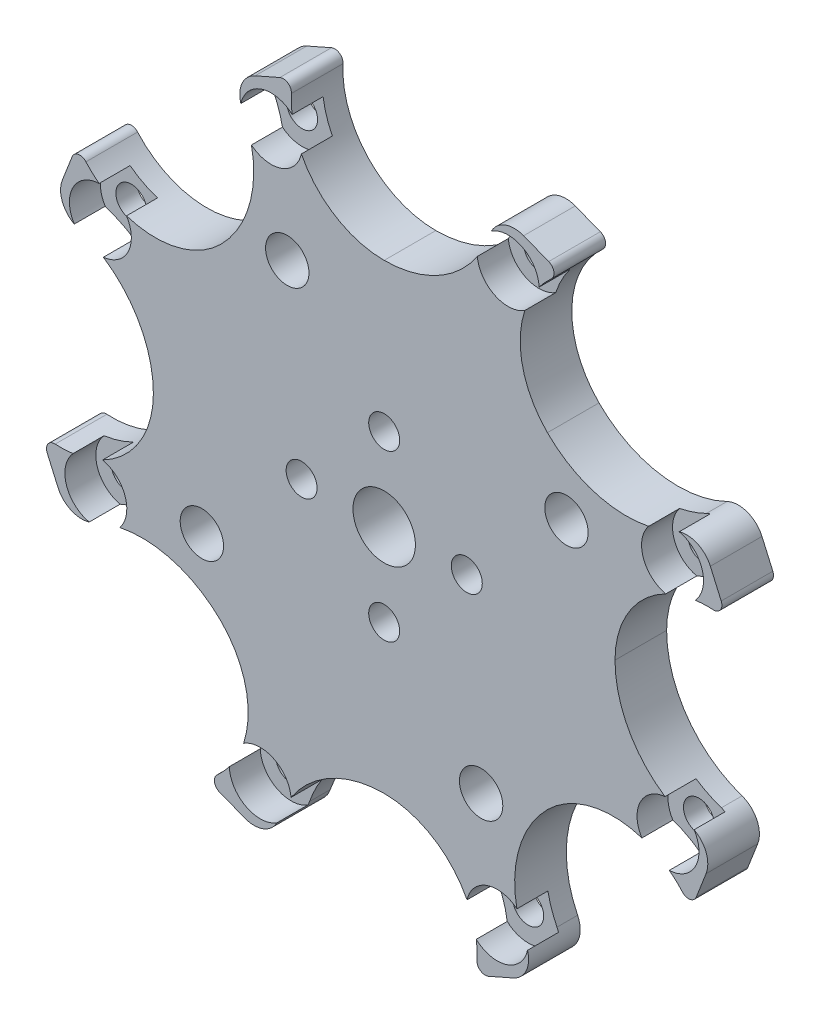
from build123d import *

# Parameters (mm, degrees)
SKETCH_1_R               = 3.025
SKETCH_1_R_2             = 1.5
EXTRUDE_1_DEPTH          = 5
SKETCH_2_R               = 2.1
CUT_EXTRUDE_1_DEPTH      = 10
SKETCH_3_R               = 1.5
CUT_EXTRUDE_3_DEPTH      = 10
SKETCH_4_R               = 0.75
CUT_EXTRUDE_4_DEPTH      = 1
PATTERN_CIRCULAR_1_COUNT = 4
SKETCH_5_R               = 3
CUT_EXTRUDE_5_DEPTH      = 3


with BuildPart() as part:
    # 草图1 → 凸台-拉伸1 (new body)
    with BuildSketch(Plane.XY):
        with BuildLine():
            Line((15.936762996, 30.229618981), (13.50337588, 31.175538906))
            ThreePointArc((13.50337588, 31.175538906), (11.545587701, 31.113280948), (10.233613318, 29.658793469))
            ThreePointArc((10.233613318, 29.658793469), (6.285609854, 24.369935979), (0, 22.357511157))
            ThreePointArc((0, 22.357511157), (-6.541634269, 25.176328334), (-8.985563862, 31.867062025))
            ThreePointArc((-8.985563862, 31.867062025), (-9.328351981, 32.569720668), (-10.106575389, 32.644561759))
            Line((-10.106575389, 32.644561759), (-12.496106314, 31.592763621))
            ThreePointArc((-12.496106314, 31.592763621), (-13.836448588, 30.1643753), (-13.73567661, 28.208191357))
            ThreePointArc((-13.73567661, 28.208191357), (-12.787549636, 21.67674434), (-15.80914775, 15.80914775))
            ThreePointArc((-15.80914775, 15.80914775), (-22.427986442, 13.176718539), (-28.887168794, 16.179662515))
            ThreePointArc((-28.887168794, 16.179662515), (-29.626411288, 16.434129403), (-30.229618981, 15.936762996))
            Line((-30.229618981, 15.936762996), (-31.175538906, 13.50337588))
            ThreePointArc((-31.175538906, 13.50337588), (-31.113280948, 11.545587701), (-29.658793469, 10.233613318))
            ThreePointArc((-29.658793469, 10.233613318), (-24.369935979, 6.285609854), (-22.357511157, 0))
            ThreePointArc((-22.357511157, 0), (-25.176328334, -6.541634269), (-31.867062025, -8.985563862))
            ThreePointArc((-31.867062025, -8.985563862), (-32.569720668, -9.328351981), (-32.644561759, -10.106575389))
            Line((-32.644561759, -10.106575389), (-31.592763621, -12.496106314))
            ThreePointArc((-31.592763621, -12.496106314), (-30.1643753, -13.836448588), (-28.208191357, -13.73567661))
            ThreePointArc((-28.208191357, -13.73567661), (-21.67674434, -12.787549636), (-15.80914775, -15.80914775))
            ThreePointArc((-15.80914775, -15.80914775), (-13.176718539, -22.427986442), (-16.179662515, -28.887168794))
            ThreePointArc((-16.179662515, -28.887168794), (-16.434129403, -29.626411288), (-15.936762996, -30.229618981))
            Line((-15.936762996, -30.229618981), (-13.50337588, -31.175538906))
            ThreePointArc((-13.50337588, -31.175538906), (-11.545587701, -31.113280948), (-10.233613318, -29.658793469))
            ThreePointArc((-10.233613318, -29.658793469), (-6.285609854, -24.369935979), (0, -22.357511157))
            ThreePointArc((0, -22.357511157), (6.541634269, -25.176328334), (8.985563862, -31.867062025))
            ThreePointArc((8.985563862, -31.867062025), (9.328351981, -32.569720668), (10.106575389, -32.644561759))
            Line((10.106575389, -32.644561759), (12.496106314, -31.592763621))
            ThreePointArc((12.496106314, -31.592763621), (13.836448588, -30.1643753), (13.73567661, -28.208191357))
            ThreePointArc((13.73567661, -28.208191357), (12.787549636, -21.67674434), (15.80914775, -15.80914775))
            ThreePointArc((15.80914775, -15.80914775), (22.427986442, -13.176718539), (28.887168794, -16.179662515))
            ThreePointArc((28.887168794, -16.179662515), (29.626411288, -16.434129403), (30.229618981, -15.936762996))
            Line((30.229618981, -15.936762996), (31.175538906, -13.50337588))
            ThreePointArc((31.175538906, -13.50337588), (31.113280948, -11.545587701), (29.658793469, -10.233613318))
            ThreePointArc((29.658793469, -10.233613318), (24.369935979, -6.285609854), (22.357511157, 0))
            ThreePointArc((22.357511157, 0), (25.176328334, 6.541634269), (31.867062025, 8.985563862))
            ThreePointArc((31.867062025, 8.985563862), (32.569720668, 9.328351981), (32.644561759, 10.106575389))
            Line((32.644561759, 10.106575389), (31.592763621, 12.496106314))
            ThreePointArc((31.592763621, 12.496106314), (30.1643753, 13.836448588), (28.208191357, 13.73567661))
            ThreePointArc((28.208191357, 13.73567661), (21.67674434, 12.787549636), (15.80914775, 15.80914775))
            ThreePointArc((15.80914775, 15.80914775), (13.176718539, 22.427986442), (16.179662515, 28.887168794))
            ThreePointArc((16.179662515, 28.887168794), (16.434129403, 29.626411288), (15.936762996, 30.229618981))
        make_face()
        Circle(SKETCH_1_R, mode=Mode.SUBTRACT)
        with Locations((-8, 0)):
            Circle(SKETCH_1_R_2, mode=Mode.SUBTRACT)
        with Locations((0, 8)):
            Circle(SKETCH_1_R_2, mode=Mode.SUBTRACT)
        with Locations((8, 0)):
            Circle(SKETCH_1_R_2, mode=Mode.SUBTRACT)
        with Locations((0, -8)):
            Circle(SKETCH_1_R_2, mode=Mode.SUBTRACT)
    extrude(amount=EXTRUDE_1_DEPTH)

    # 草图2 → 切除-拉伸1 (cut)
    with BuildSketch(Plane.XY.offset(5)):
        with Locations((-17.658951857, -9.389431256)):
            Circle(SKETCH_2_R)
        with Locations((-9.389431256, 17.658951857)):
            Circle(SKETCH_2_R)
        with Locations((17.658951857, 9.389431256)):
            Circle(SKETCH_2_R)
        with Locations((9.389431256, -17.658951857)):
            Circle(SKETCH_2_R)
    extrude(amount=-CUT_EXTRUDE_1_DEPTH, mode=Mode.SUBTRACT)

    # 草图3 → 切除-拉伸3 (cut)
    with BuildSketch(Plane.XY.offset(5)):
        with Locations((-10.95008804, 27.930191047)):
            Circle(SKETCH_3_R)
        with Locations((12.006745981, 27.492508997)):
            Circle(SKETCH_3_R)
        with Locations((27.930191047, 10.95008804)):
            Circle(SKETCH_3_R)
        with Locations((27.492508997, -12.006745981)):
            Circle(SKETCH_3_R)
        with Locations((10.95008804, -27.930191047)):
            Circle(SKETCH_3_R)
        with Locations((-12.006745981, -27.492508997)):
            Circle(SKETCH_3_R)
        with Locations((-27.930191047, -10.95008804)):
            Circle(SKETCH_3_R)
        with Locations((-27.492508997, 12.006745981)):
            Circle(SKETCH_3_R)
    extrude(amount=-CUT_EXTRUDE_3_DEPTH, mode=Mode.SUBTRACT)

    # 草图4 → 切除-拉伸4 (cut)
    with BuildSketch(Plane(origin=(0, 0, 0), x_dir=(-1, 0, 0), z_dir=(0, 0, -1))):
        with Locations((-20.220960702, 8.332969861)):
            Circle(SKETCH_4_R)
        with Locations((-18.025033874, 6.642435814)):
            Circle(SKETCH_4_R)
        with Locations((-15.463025029, 7.698897208)):
            Circle(SKETCH_4_R)
        with Locations((-15.096943012, 10.44589265)):
            Circle(SKETCH_4_R)
        with Locations((-17.29286984, 12.136426697)):
            Circle(SKETCH_4_R)
        with Locations((-19.854878685, 11.079965303)):
            Circle(SKETCH_4_R)
        Polygon((-20.220960702, 8.332969861), (-18.025033874, 6.642435814), (-15.463025029, 7.698897208), (-15.096943012, 10.44589265), (-17.29286984, 12.136426697), (-19.854878685, 11.079965303), align=None)
        with BuildLine():
            ThreePointArc((-17.986233823, 11.850513446), (-17.391943692, 11.392999249), (-16.69857971, 11.6789125))
            Line((-16.69857971, 11.6789125), (-17.29286984, 12.136426697))
            Line((-17.29286984, 12.136426697), (-17.986233823, 11.850513446))
        make_face()
        with BuildLine():
            Line((-17.29286984, 12.136426697), (-16.69857971, 11.6789125))
            ThreePointArc((-16.69857971, 11.6789125), (-16.582863644, 11.894783984), (-16.54286984, 12.136426697))
            ThreePointArc((-16.54286984, 12.136426697), (-17.43860421, 12.872131457), (-17.986233823, 11.850513446))
            Line((-17.986233823, 11.850513446), (-17.29286984, 12.136426697))
        make_face()
        with BuildLine():
            ThreePointArc((-15.691233143, 10.903406847), (-15.790306995, 10.159979398), (-15.196016864, 9.702465201))
            Line((-15.196016864, 9.702465201), (-15.096943012, 10.44589265))
            Line((-15.096943012, 10.44589265), (-15.691233143, 10.903406847))
        make_face()
        with BuildLine():
            Line((-15.096943012, 10.44589265), (-15.196016864, 9.702465201))
            ThreePointArc((-15.196016864, 9.702465201), (-14.602880966, 9.881620823), (-14.346943012, 10.44589265))
            ThreePointArc((-14.346943012, 10.44589265), (-14.855300299, 11.155898847), (-15.691233143, 10.903406847))
            Line((-15.691233143, 10.903406847), (-15.096943012, 10.44589265))
        make_face()
        with BuildLine():
            ThreePointArc((-19.104878685, 11.079965303), (-19.119173926, 11.225699673), (-19.161514703, 11.365878555))
            Line((-19.161514703, 11.365878555), (-19.854878685, 11.079965303))
            Line((-19.854878685, 11.079965303), (-19.953952537, 10.336537854))
            ThreePointArc((-19.953952537, 10.336537854), (-19.360816639, 10.515693476), (-19.104878685, 11.079965303))
        make_face()
        with BuildLine():
            Line((-19.854878685, 11.079965303), (-19.161514703, 11.365878555))
            ThreePointArc((-19.161514703, 11.365878555), (-20.449168816, 11.5374795), (-19.953952537, 10.336537854))
            Line((-19.953952537, 10.336537854), (-19.854878685, 11.079965303))
        make_face()
        with BuildLine():
            ThreePointArc((-20.12188685, 9.07639731), (-20.914324685, 8.047056609), (-19.626670572, 7.875455664))
            Line((-19.626670572, 7.875455664), (-20.220960702, 8.332969861))
            Line((-20.220960702, 8.332969861), (-20.12188685, 9.07639731))
        make_face()
        with BuildLine():
            Line((-20.220960702, 8.332969861), (-19.626670572, 7.875455664))
            ThreePointArc((-19.626670572, 7.875455664), (-19.510954506, 8.091327148), (-19.470960702, 8.332969861))
            ThreePointArc((-19.470960702, 8.332969861), (-19.656688875, 8.827031907), (-20.12188685, 9.07639731))
            Line((-20.12188685, 9.07639731), (-20.220960702, 8.332969861))
        make_face()
        with BuildLine():
            ThreePointArc((-17.275033874, 6.642435814), (-17.289329114, 6.788170184), (-17.331669891, 6.928349066))
            Line((-17.331669891, 6.928349066), (-18.025033874, 6.642435814))
            Line((-18.025033874, 6.642435814), (-18.619324005, 7.099950011))
            ThreePointArc((-18.619324005, 7.099950011), (-18.266676587, 5.932429618), (-17.275033874, 6.642435814))
        make_face()
        with BuildLine():
            Line((-18.025033874, 6.642435814), (-17.331669891, 6.928349066))
            ThreePointArc((-17.331669891, 6.928349066), (-17.925960022, 7.385863263), (-18.619324005, 7.099950011))
            Line((-18.619324005, 7.099950011), (-18.025033874, 6.642435814))
        make_face()
        with BuildLine():
            Line((-16.156389012, 7.412983957), (-15.463025029, 7.698897208))
            Line((-15.463025029, 7.698897208), (-15.363951177, 8.442324657))
            ThreePointArc((-15.363951177, 8.442324657), (-16.05731516, 8.156411406), (-16.156389012, 7.412983957))
        make_face()
        with BuildLine():
            Line((-15.363951177, 8.442324657), (-15.463025029, 7.698897208))
            Line((-15.463025029, 7.698897208), (-16.156389012, 7.412983957))
            ThreePointArc((-16.156389012, 7.412983957), (-15.317290659, 6.963192449), (-14.713025029, 7.698897208))
            ThreePointArc((-14.713025029, 7.698897208), (-14.898753202, 8.192959255), (-15.363951177, 8.442324657))
        make_face()
    cut_extrude_4 = extrude(amount=-CUT_EXTRUDE_4_DEPTH, mode=Mode.SUBTRACT)

    # 阵列(圆周)1: 切除-拉伸4 ×4 about axis
    pattern_circular_1_axis = Axis((0, 0, 0), (0, 0, 1))
    for i in range(1, PATTERN_CIRCULAR_1_COUNT):
        add(cut_extrude_4.rotate(pattern_circular_1_axis, i * 360 / PATTERN_CIRCULAR_1_COUNT), mode=Mode.SUBTRACT)

    # 草图5 → 切除-拉伸5 (cut)
    with BuildSketch(Plane.XY.offset(5)):
        with Locations((12.006745981, 27.492508997)):
            Circle(SKETCH_5_R)
        with Locations((27.930191047, 10.95008804)):
            Circle(SKETCH_5_R)
        with Locations((27.492508997, -12.006745981)):
            Circle(SKETCH_5_R)
        with Locations((10.95008804, -27.930191047)):
            Circle(SKETCH_5_R)
        with Locations((-12.006745981, -27.492508997)):
            Circle(SKETCH_5_R)
        with Locations((-27.930191047, -10.95008804)):
            Circle(SKETCH_5_R)
        with Locations((-27.492508997, 12.006745981)):
            Circle(SKETCH_5_R)
        with Locations((-10.95008804, 27.930191047)):
            Circle(SKETCH_5_R)
    extrude(amount=-CUT_EXTRUDE_5_DEPTH, mode=Mode.SUBTRACT)


solid = part.part
